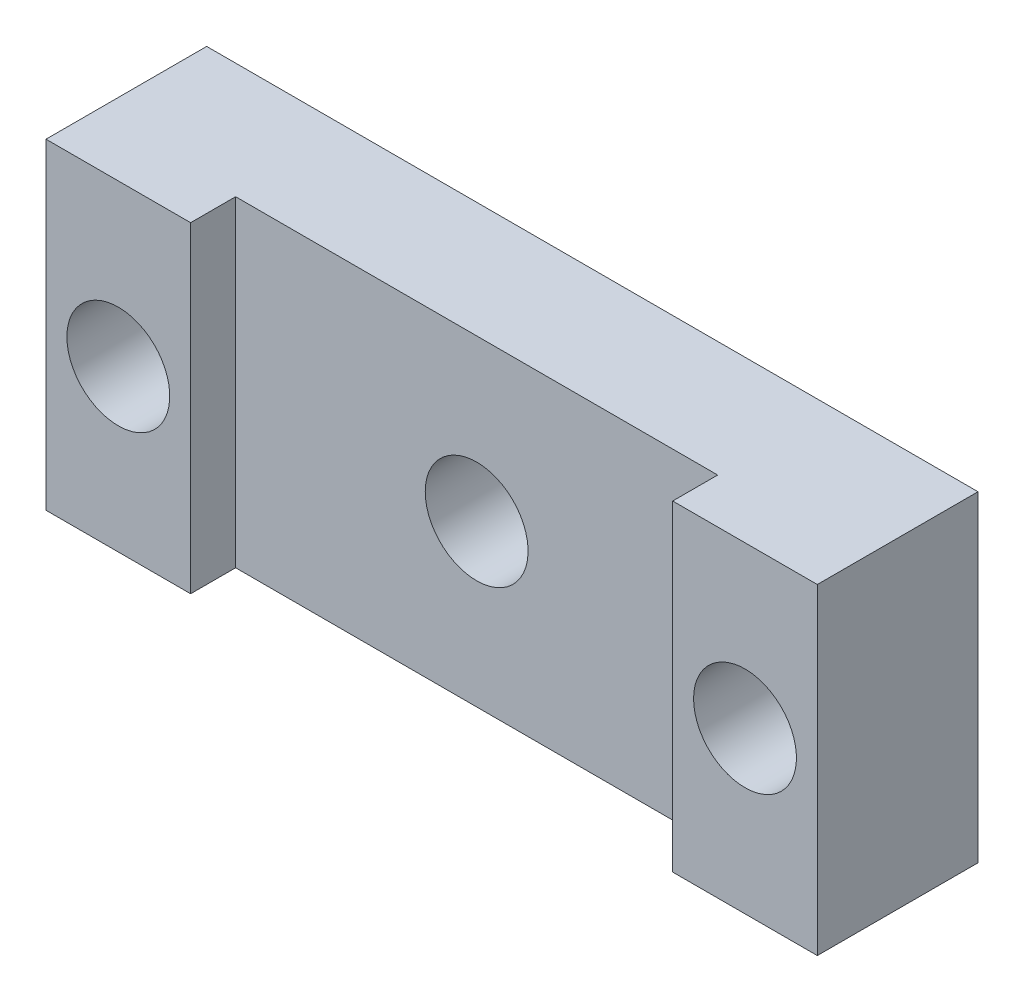
from build123d import *

# Parameters (mm, degrees)
BOSS_EXTRUDE1_DEPTH              = 5
F_97_0_0059_DIAMETER_HOLE1_D     = 1.600000102
F_97_0_0059_DIAMETER_HOLE1_DEPTH = 3
M2X0_4_TAPPED_HOLE1_D            = 1.6
M2X0_4_TAPPED_HOLE1_DEPTH        = 5.2
M2X0_4_TAPPED_HOLE1_TIP          = 0.480688495


with BuildPart() as part:
    # Sketch1 → Boss-Extrude1 (new body)
    with BuildSketch(Plane(origin=(0, 0, 0), x_dir=(1, 0, 0), z_dir=(0, 1, 0))):
        Polygon((0, 0), (2.25, 0), (2.25, 0.7), (9.75, 0.7), (9.75, 0), (12, 0), (12, 2.5), (0, 2.5), align=None)
    extrude(amount=BOSS_EXTRUDE1_DEPTH)

    # #97 (0.0059) Diameter Hole1
    with Locations(Plane(origin=(0, 0, -2.5), x_dir=(-1, 0, 0), z_dir=(0, 0, -1))):
        with Locations((-10.875, 2.5)):
            f_97_0_0059_diameter_hole1 = Hole(F_97_0_0059_DIAMETER_HOLE1_D / 2, depth=F_97_0_0059_DIAMETER_HOLE1_DEPTH)

    # M2x0.4 Tapped Hole1
    with Locations(Plane(origin=(0, 0, -2.5), x_dir=(-1, 0, 0), z_dir=(0, 0, -1))):
        with Locations((-6, 2.5)):
            Hole(M2X0_4_TAPPED_HOLE1_D / 2, depth=M2X0_4_TAPPED_HOLE1_DEPTH)
            with Locations((0, 0, -(M2X0_4_TAPPED_HOLE1_DEPTH + M2X0_4_TAPPED_HOLE1_TIP / 2))):  # 118° drill point
                Cone(0, M2X0_4_TAPPED_HOLE1_D / 2, M2X0_4_TAPPED_HOLE1_TIP, mode=Mode.SUBTRACT)

    # Mirror1: #97 (0.0059) Diameter Hole1 across plane
    add(f_97_0_0059_diameter_hole1.mirror(Plane(origin=(6, 0, 0), x_dir=(0, 0, 1), z_dir=(1, 0, 0))), mode=Mode.SUBTRACT)


solid = part.part
